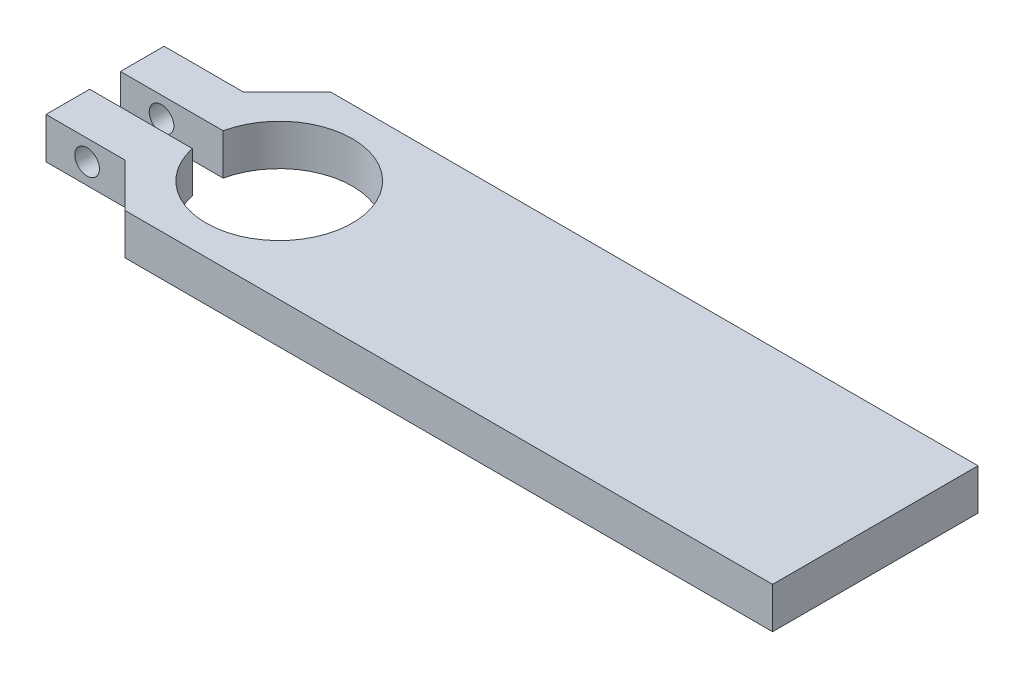
from build123d import *

# Parameters (mm, degrees)
SKETCH1_W               = 75
SKETCH1_H               = 20
BOSS_EXTRUDE1_DEPTH     = 4
CUT_EXTRUDE1_DEPTH      = 78.723870207
CUT_EXTRUDE1_DEPTH_BACK = 4
M2_CLEARANCE_HOLE1_D    = 2.4
CUT_EXTRUDE2_DEPTH      = 4


with BuildPart() as part:
    # Sketch1 → Boss-Extrude1 (new body)
    with BuildSketch(Plane(origin=(0, 0, 0), x_dir=(1, 0, 0), z_dir=(0, 1, 0))):
        with Locations((37.5, 10)):
            Rectangle(SKETCH1_W, SKETCH1_H)
    extrude(amount=BOSS_EXTRUDE1_DEPTH)

    # Sketch2 → Cut-Extrude1 (cut, two sides: drawn at the far end of the back side and taken through both)
    with BuildSketch(Plane(origin=(0, 4, 0), x_dir=(1, 0, 0), z_dir=(0, 1, 0)).offset(-CUT_EXTRUDE1_DEPTH_BACK)):
        with BuildLine():
            Line((0, 8.5), (10, 8.5))
            ThreePointArc((10, 8.5), (24.080201147, 10), (10, 11.5))
            Line((10, 11.5), (0, 11.5))
            Line((0, 11.5), (0, 10))
            Line((0, 10), (0, 8.5))
        make_face()
    extrude(amount=CUT_EXTRUDE1_DEPTH + CUT_EXTRUDE1_DEPTH_BACK, mode=Mode.SUBTRACT)

    # M2 Clearance Hole1 (through all)
    with Locations(Plane(origin=(0, 0, -20), x_dir=(-1, 0, 0), z_dir=(0, 0, -1))):
        with Locations((-4, 2)):
            Hole(M2_CLEARANCE_HOLE1_D / 2)

    # Sketch5 → Cut-Extrude2 (cut)
    with BuildSketch(Plane(origin=(0, 4, 0), x_dir=(1, 0, 0), z_dir=(0, 1, 0))):
        Polygon((0, 15.75), (7.691253114, 15.75), (11.941253114, 20), (0, 20), align=None)
        Polygon((0, 0), (0, 4.25), (7.691253114, 4.25), (11.941253114, 0), align=None)
    extrude(amount=-CUT_EXTRUDE2_DEPTH, mode=Mode.SUBTRACT)


solid = part.part
